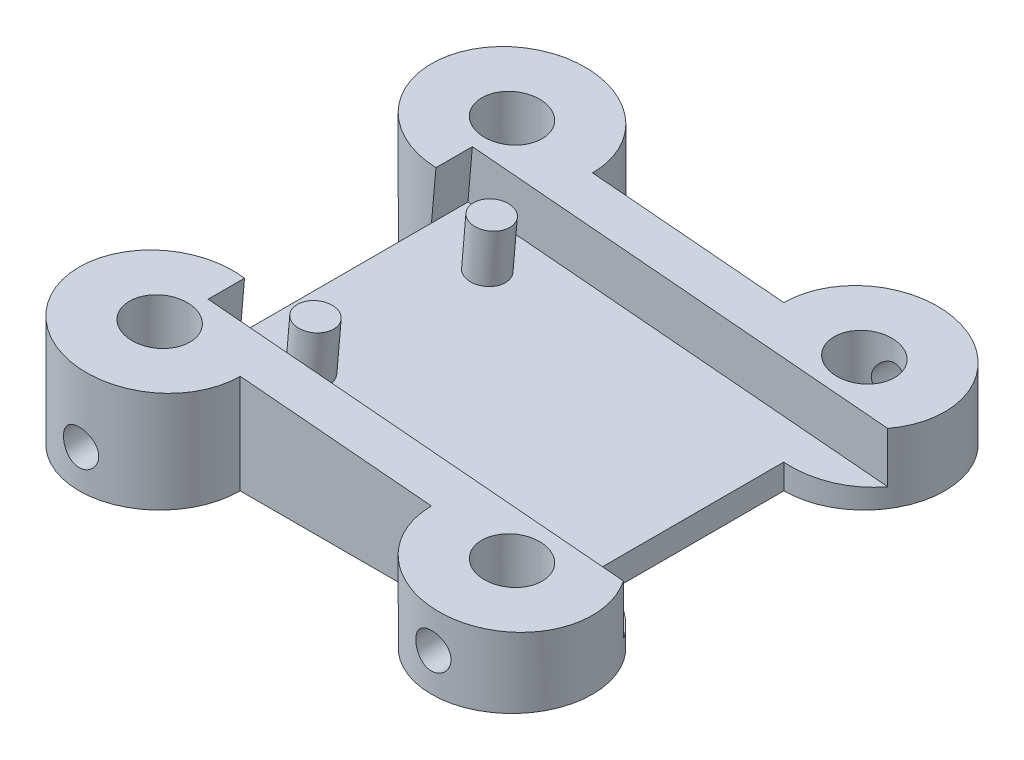
from build123d import *

# Parameters (mm, degrees)
SKETCH1_W           = 28
SKETCH1_H           = 28
BOSS_EXTRUDE1_DEPTH = 8.449682579
CUT_EXTRUDE1_DEPTH  = 41.489469442
SKETCH3_W           = 50
SKETCH3_H           = 21
CUT_EXTRUDE2_DEPTH  = 4
SKETCH11_R          = 1.45
BOSS_EXTRUDE2_DEPTH = 4
SKETCH13_R          = 2.4
CUT_EXTRUDE5_DEPTH  = 41.489469442
BOSS_EXTRUDE3_REACH = 42.489
SKETCH14_R          = 6.4
SKETCH14_R_2        = 2.4
SKETCH15_R          = 1.4
CUT_EXTRUDE6_DEPTH  = 50.476186927
SKETCH16_R          = 1.4
CUT_EXTRUDE7_DEPTH  = 50.476187084
SKETCH18_W          = 30
SKETCH18_H          = 21
CUT_EXTRUDE8_DEPTH  = 4


with BuildPart() as part:
    # Sketch1 → Boss-Extrude1 (new body)
    with BuildSketch(Plane(origin=(0, 0, 0), x_dir=(1, 0, 0), z_dir=(0, 1, 0))):
        with Locations((14, 14)):
            Rectangle(SKETCH1_W, SKETCH1_H)
    extrude(amount=BOSS_EXTRUDE1_DEPTH)

    # Sketch2 → Cut-Extrude1 (cut, through all)
    with BuildSketch(Plane.XY):
        Polygon((0, 8.449682579), (28, 6), (28, 8.449682579), align=None)
    extrude(amount=-CUT_EXTRUDE1_DEPTH, mode=Mode.SUBTRACT)

    # Sketch3 → Cut-Extrude2 (cut)
    with BuildSketch(Plane(origin=(0.733635991, 8.385497746, 0), x_dir=(0.9961946980917455, -0.08715574274765811, 0), z_dir=(0.08715574274765811, 0.9961946980917455, 0))):
        with Locations((24.263561639, 14)):
            Rectangle(SKETCH3_W, SKETCH3_H)
    extrude(amount=-CUT_EXTRUDE2_DEPTH, mode=Mode.SUBTRACT)

    # Sketch11 → Boss-Extrude2 (add)
    with BuildSketch(Plane(origin=(0.38501302, 4.400718954, 0), x_dir=(0.9961946980917457, -0.08715574274765812, 0), z_dir=(0.08715574274765812, 0.9961946980917457, 0))):
        with Locations((4.666994019, 21)):
            Circle(SKETCH11_R)
        with Locations((4.666994019, 7)):
            Circle(SKETCH11_R)
    extrude(amount=BOSS_EXTRUDE2_DEPTH)

    # Sketch13 → Cut-Extrude5 (cut, through all)
    with BuildSketch(Plane.XZ):
        Circle(SKETCH13_R)
        with Locations((28, 0)):
            Circle(SKETCH13_R)
        with Locations((28, -28)):
            Circle(SKETCH13_R)
        with Locations((0, -28)):
            Circle(SKETCH13_R)
    extrude(amount=-CUT_EXTRUDE5_DEPTH, mode=Mode.SUBTRACT)

    # Boss-Extrude3: up to this plane
    boss_extrude3_end = Plane(origin=(0, 8.449682579, -28), z_dir=(-0.08715574274765814, -0.9961946980917457, 0))
    # Sketch14 → Boss-Extrude3 (add, up to the surface)
    with BuildSketch(Plane.XZ, mode=Mode.PRIVATE) as boss_extrude3_sk1:
        Circle(SKETCH14_R)
        with Locations(Location((0, 0, 0), (0, 0, 270))):
            Circle(SKETCH14_R_2, mode=Mode.SUBTRACT)
    boss_extrude3_tool1 = split(extrude(boss_extrude3_sk1.sketch, amount=-BOSS_EXTRUDE3_REACH, mode=Mode.PRIVATE), bisect_by=boss_extrude3_end, keep=Keep.BOTH, mode=Mode.PRIVATE)
    add(boss_extrude3_tool1.solids().sort_by_distance((-6.218981, 0, 0))[0])
    # Sketch14 → Boss-Extrude3 (add, up to the surface)
    with BuildSketch(Plane.XZ, mode=Mode.PRIVATE) as boss_extrude3_sk2:
        with Locations((28, 0)):
            Circle(SKETCH14_R)
        with Locations(Location((28, 0, 0), (0, 0, 270))):
            Circle(SKETCH14_R_2, mode=Mode.SUBTRACT)
    boss_extrude3_tool2 = split(extrude(boss_extrude3_sk2.sketch, amount=-BOSS_EXTRUDE3_REACH, mode=Mode.PRIVATE), bisect_by=boss_extrude3_end, keep=Keep.BOTH, mode=Mode.PRIVATE)
    add(boss_extrude3_tool2.solids().sort_by_distance((21.781019, 0, 0))[0])
    # Sketch14 → Boss-Extrude3 (add, up to the surface)
    with BuildSketch(Plane.XZ, mode=Mode.PRIVATE) as boss_extrude3_sk3:
        with Locations((28, -28)):
            Circle(SKETCH14_R)
        with Locations(Location((28, -28, 0), (0, 0, 270))):
            Circle(SKETCH14_R_2, mode=Mode.SUBTRACT)
    boss_extrude3_tool3 = split(extrude(boss_extrude3_sk3.sketch, amount=-BOSS_EXTRUDE3_REACH, mode=Mode.PRIVATE), bisect_by=boss_extrude3_end, keep=Keep.BOTH, mode=Mode.PRIVATE)
    add(boss_extrude3_tool3.solids().sort_by_distance((21.781019, 0, -28))[0])
    # Sketch14 → Boss-Extrude3 (add, up to the surface)
    with BuildSketch(Plane.XZ, mode=Mode.PRIVATE) as boss_extrude3_sk4:
        with Locations((0, -28)):
            Circle(SKETCH14_R)
        with Locations(Location((0, -28, 0), (0, 0, 270))):
            Circle(SKETCH14_R_2, mode=Mode.SUBTRACT)
    boss_extrude3_tool4 = split(extrude(boss_extrude3_sk4.sketch, amount=-BOSS_EXTRUDE3_REACH, mode=Mode.PRIVATE), bisect_by=boss_extrude3_end, keep=Keep.BOTH, mode=Mode.PRIVATE)
    add(boss_extrude3_tool4.solids().sort_by_distance((-6.218981, 0, -28))[0])

    # Sketch15 → Cut-Extrude6 (cut, through all)
    with BuildSketch(Plane(origin=(0, 0, -28), x_dir=(-1, 0, 0), z_dir=(0, 0, -1))):
        with Locations(Location((-28, 3, 0), (0, 0, 270))):
            Circle(SKETCH15_R)
        with Locations(Location((0, 3, 0), (0, 0, 90))):
            Circle(SKETCH15_R)
    extrude(amount=CUT_EXTRUDE6_DEPTH, mode=Mode.SUBTRACT)

    # Sketch16 → Cut-Extrude7 (cut, through all)
    with BuildSketch(Plane.XY):
        with Locations(Location((0, 3, 0), (0, 0, 90))):
            Circle(SKETCH16_R)
        with Locations(Location((28, 3, 0), (0, 0, 270))):
            Circle(SKETCH16_R)
    extrude(amount=CUT_EXTRUDE7_DEPTH, mode=Mode.SUBTRACT)

    # Sketch18 → Cut-Extrude8 (cut)
    with BuildSketch(Plane(origin=(0.733635991, 8.385497746, 0), x_dir=(0.9961946980917455, -0.08715574274765811, 0), z_dir=(0.08715574274765811, 0.9961946980917455, 0))):
        with BuildLine():
            Line((4.992154967, 24.5), (-0.386483707, 24.5))
            Line((-0.386483707, 24.5), (-0.386483707, 21.6))
            add(Edge.make_bspline(
                [(-0.386483707, 21.6), (3.090616042, 21.6), (4.992154967, 24.5)],
                knots=[4.71238898, 4.71238898, 4.71238898, 5.704558256, 5.704558256, 5.704558256], degree=2, weights=[1, 0.879452955, 1]))
        make_face()
        with Locations((21.991878416, 14)):
            Rectangle(SKETCH18_W, SKETCH18_H)
        with BuildLine():
            Line((-0.386483707, 6.4), (-0.386483707, 3.5))
            Line((-0.386483707, 3.5), (4.992154967, 3.5))
            add(Edge.make_bspline(
                [(4.992154967, 3.5), (3.090616042, 6.4), (-0.386483707, 6.4)],
                knots=[0.578627051, 0.578627051, 0.578627051, 1.570796327, 1.570796327, 1.570796327], degree=2, weights=[1, 0.879452955, 1]))
        make_face()
    extrude(amount=-CUT_EXTRUDE8_DEPTH, mode=Mode.SUBTRACT)


solid = part.part
